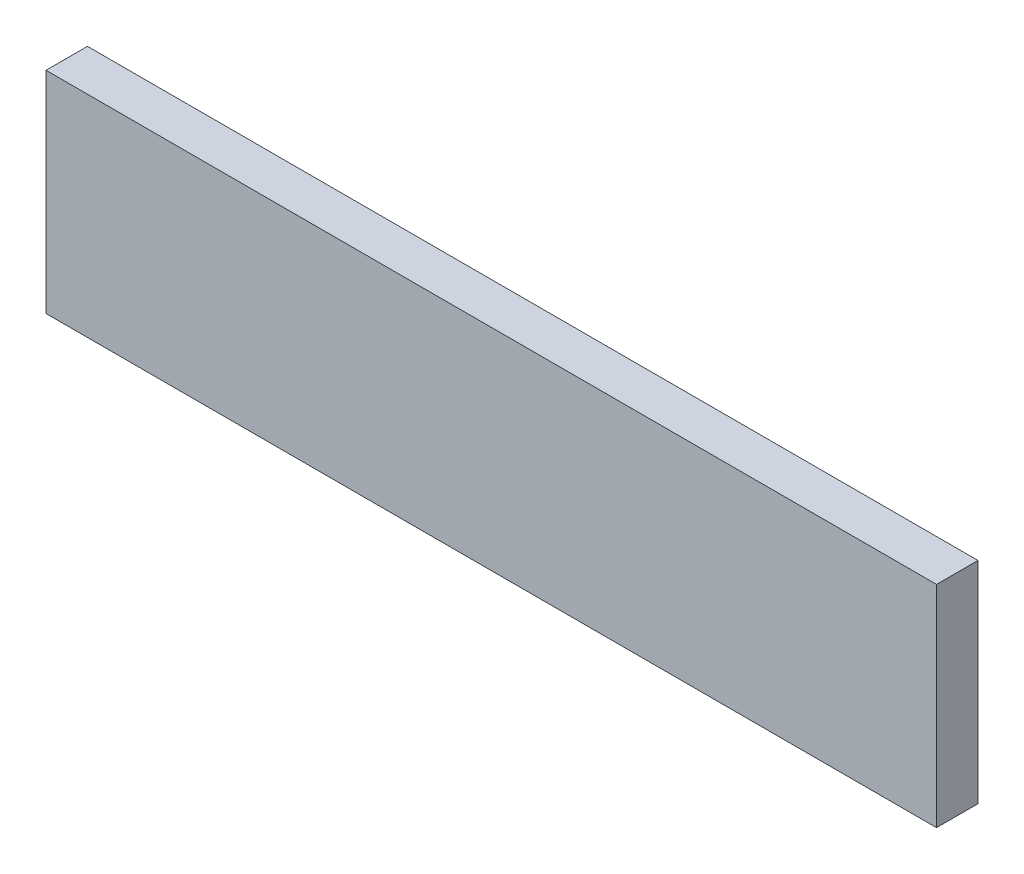
from build123d import *

# Parameters (mm, degrees)
SKETCH_1_W      = 322.1
SKETCH_1_H      = 76.2
EXTRUDE_1_DEPTH = 15


with BuildPart() as part:
    # 草图1 → 凸台-拉伸1 (new body)
    with BuildSketch(Plane.XY):
        with Locations((161.05, 38.1)):
            Rectangle(SKETCH_1_W, SKETCH_1_H)
    extrude(amount=EXTRUDE_1_DEPTH)


solid = part.part
